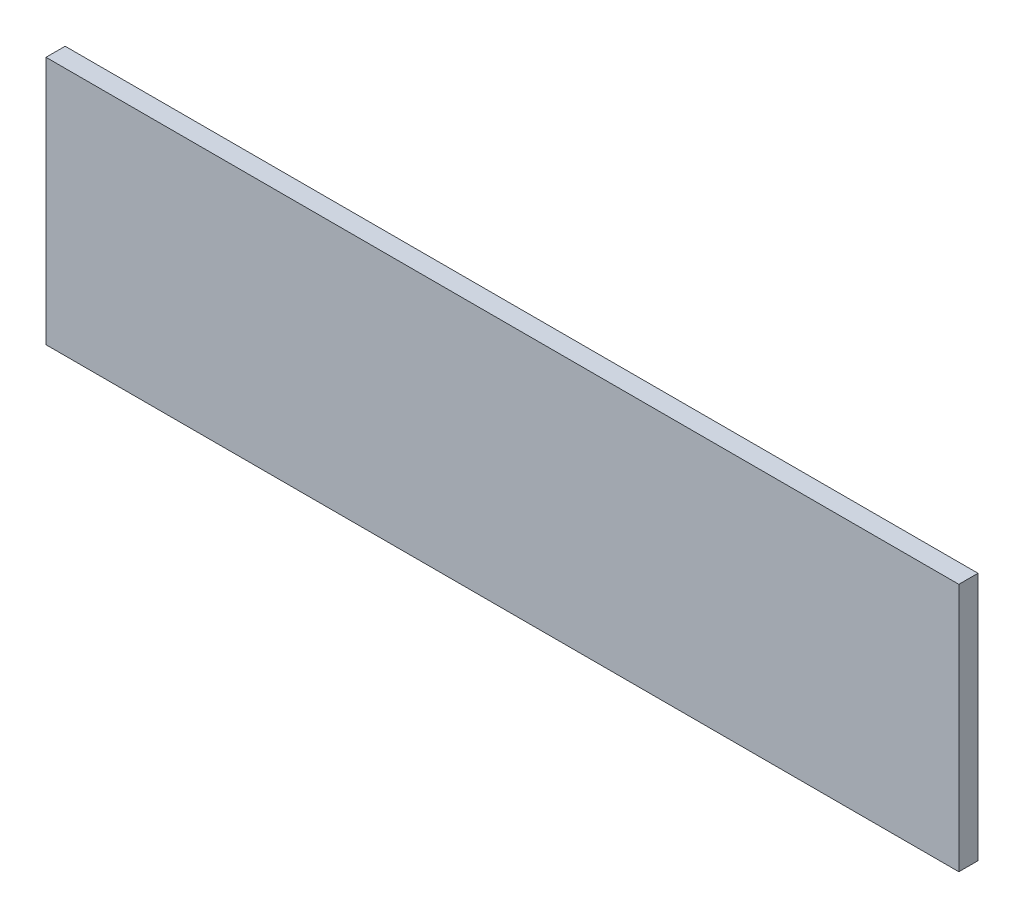
from build123d import *

# Parameters (mm, degrees)
SKETCH1_W           = 286
SKETCH1_H           = 78
BOSS_EXTRUDE1_DEPTH = 6


with BuildPart() as part:
    # Sketch1 → Boss-Extrude1 (new body)
    with BuildSketch(Plane.XY):
        Rectangle(SKETCH1_W, SKETCH1_H)
    extrude(amount=BOSS_EXTRUDE1_DEPTH)


solid = part.part
